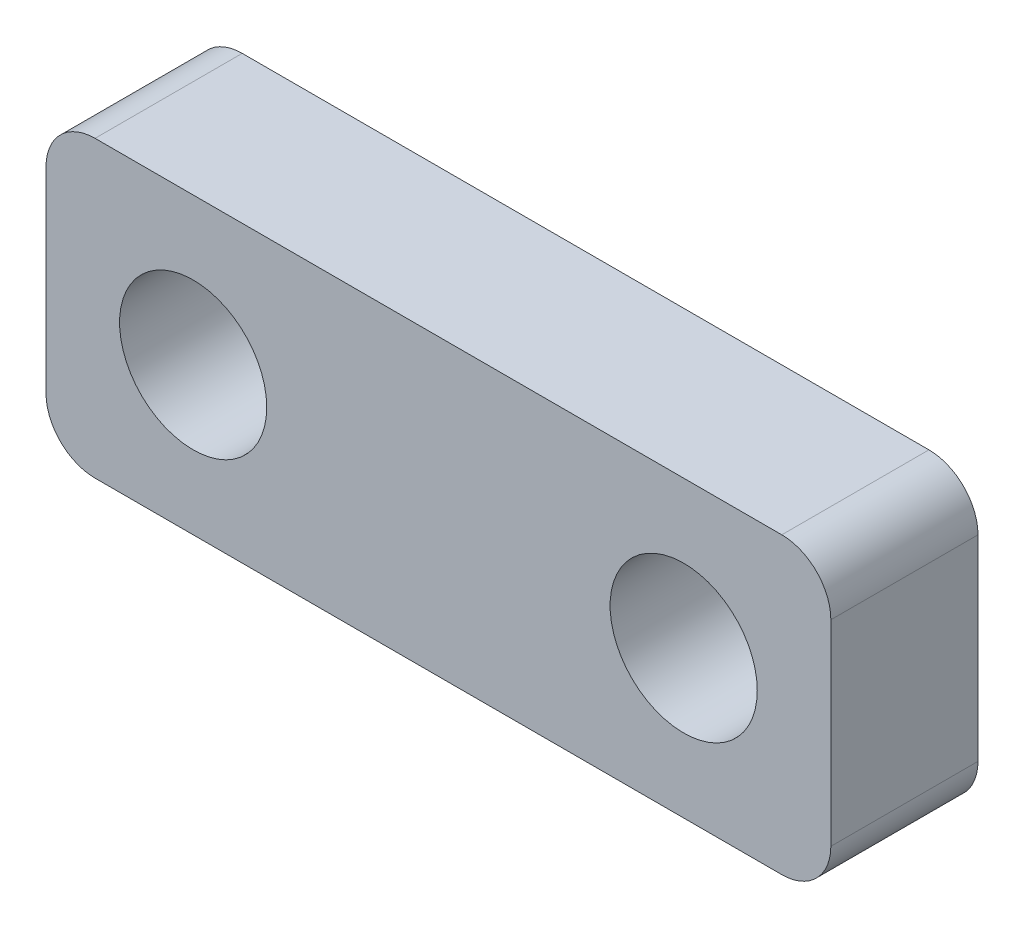
from build123d import *

# Parameters (mm, degrees)
SKETCH_1_W          = 16
SKETCH_1_H          = 6
EXTRUDE_1_DEPTH     = 3
SKETCH_2_R          = 1.5
CUT_EXTRUDE_1_DEPTH = 10.055385138
FILLET_1_R          = 1


with BuildPart() as part:
    # 草图1 → 凸台-拉伸1 (new body)
    with BuildSketch(Plane.XY):
        Rectangle(SKETCH_1_W, SKETCH_1_H)
    extrude(amount=EXTRUDE_1_DEPTH)

    # 草图2 → 切除-拉伸1 (cut, through all)
    with BuildSketch(Plane.XY.offset(3)):
        with Locations((-5, 0)):
            Circle(SKETCH_2_R)
        with Locations((5, 0)):
            Circle(SKETCH_2_R)
    extrude(amount=-CUT_EXTRUDE_1_DEPTH, mode=Mode.SUBTRACT)

    # 圆角1
    fillet_1_edges = [part.edges().sort_by_distance(p)[0] for p in [
        (8, -3, 1.5),
        (-8, -3, 1.5),
        (-8, 3, 1.5),
        (8, 3, 1.5),
    ]]
    fillet(fillet_1_edges, radius=FILLET_1_R)


solid = part.part
